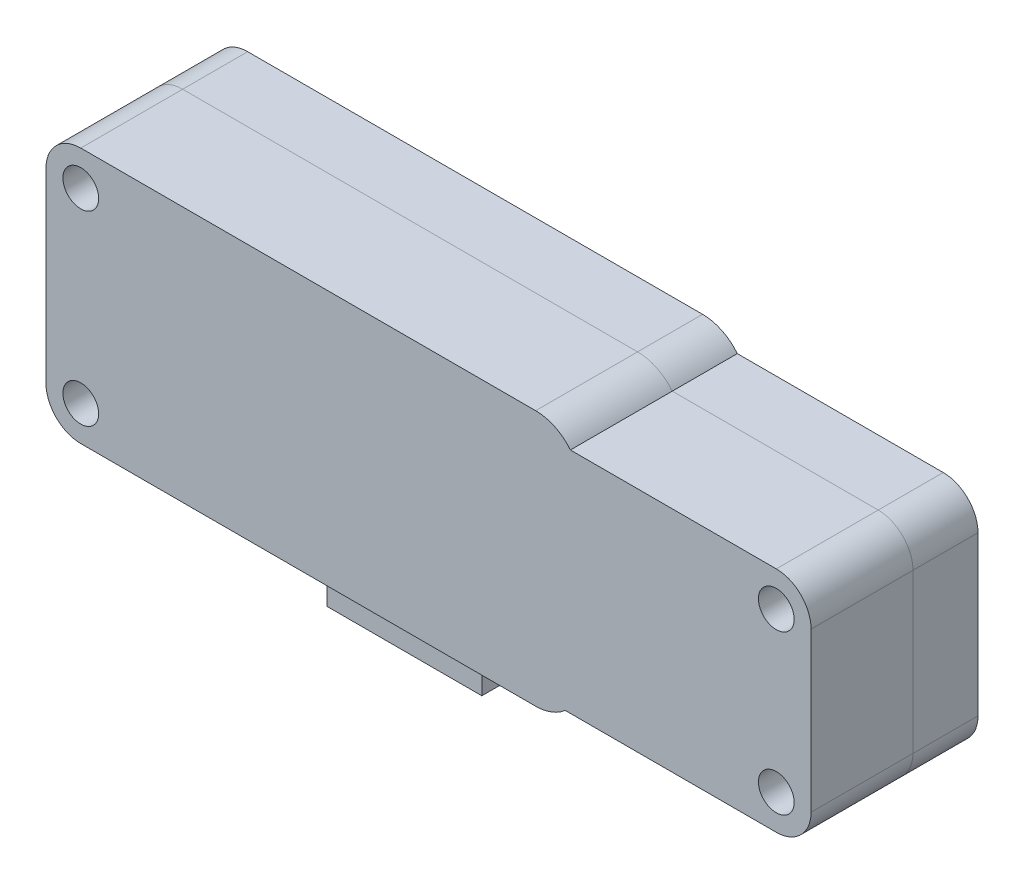
from build123d import *

# Parameters (mm, degrees)
BOSS_EXTRUDE1_START             = 2.032
BOSS_EXTRUDE1_DEPTH             = 12.7
BOSS_EXTRUDE2_DEPTH             = 3.27
BOSS_EXTRUDE2_DEPTH_BACK        = 3.27
SKETCH2_W                       = 14.14
SKETCH2_H                       = 7.9502
SKETCH3_W                       = 36.079999008
SKETCH3_H                       = 20.829999962
BOSS_EXTRUDE3_DEPTH             = 2.54
BOSS_EXTRUDE3_DIRECTION_2_REACH = 31.949
SKETCH7_W                       = 6.024
SKETCH7_H                       = 3.524
CUT_EXTRUDE1_DEPTH              = 2.54
BOSS_EXTRUDE5_DEPTH             = 12.7
F_4_CLEARANCE_HOLE4_D           = 3.2639
BOSS_EXTRUDE6_DEPTH             = 15.24
F_4_CLEARANCE_HOLE5_D           = 3.2639
SKETCH17_R                      = 1.63195
BOSS_EXTRUDE8_DEPTH             = 2.54


with BuildPart() as part:
    # Sketch1 → Boss-Extrude1 (new body)
    with BuildSketch(Plane.XY.offset(BOSS_EXTRUDE1_START)):
        with BuildLine():
            Line((-21.844, 7.62), (-21.844, -7.62))
            ThreePointArc((-21.844, -7.62), (-20.653681959, -10.493681959), (-17.78, -11.684))
            Line((-17.78, -11.684), (17.78, -11.684))
            ThreePointArc((17.78, -11.684), (20.653681959, -10.493681959), (21.844, -7.62))
            Line((21.844, -7.62), (21.844, 7.62))
            ThreePointArc((21.844, 7.62), (20.653681959, 10.493681959), (17.78, 11.684))
            Line((17.78, 11.684), (-17.78, 11.684))
            ThreePointArc((-17.78, 11.684), (-20.653681959, 10.493681959), (-21.844, 7.62))
        make_face()
    extrude(amount=-BOSS_EXTRUDE1_DEPTH)

    # Sketch2 → Boss-Extrude2 (add, two sides: drawn at the far end of the back side and taken through both)
    with BuildSketch(Plane(origin=(0, 0, -4), x_dir=(-1, 0, 0), z_dir=(0, 0, -1)).offset(-BOSS_EXTRUDE2_DEPTH_BACK)):
        with Locations((-3.036000992, -12.10347265)):
            Rectangle(SKETCH2_W, SKETCH2_H)
    extrude(amount=BOSS_EXTRUDE2_DEPTH + BOSS_EXTRUDE2_DEPTH_BACK)

    # Sketch3 → Boss-Extrude3 (add)
    with BuildSketch(Plane(origin=(0, 0, -10.668), x_dir=(-1, 0, 0), z_dir=(0, 0, -1))):
        with Locations((-19.806000496, -0.253372669)):
            Rectangle(SKETCH3_W, SKETCH3_H)
    extrude(amount=BOSS_EXTRUDE3_DEPTH)

    # Boss-Extrude3 direction 2: up to this face of the body (flat: up to its plane)
    boss_extrude3_direction_2_end = Plane(part.part.faces().sort_by_distance((0, 0, 2.032))[0])
    # Sketch3 → Boss-Extrude3 direction 2 (add, up to the picked face)
    with BuildSketch(Plane(origin=(0, 0, -10.668), x_dir=(-1, 0, 0), z_dir=(0, 0, -1)), mode=Mode.PRIVATE) as boss_extrude3_direction_2_sk1:
        with Locations((-19.806000496, -0.253372669)):
            Rectangle(SKETCH3_W, SKETCH3_H)
    boss_extrude3_direction_2_tool1 = split(extrude(boss_extrude3_direction_2_sk1.sketch, amount=-BOSS_EXTRUDE3_DIRECTION_2_REACH, mode=Mode.PRIVATE), bisect_by=boss_extrude3_direction_2_end, keep=Keep.BOTH, mode=Mode.PRIVATE)
    add(boss_extrude3_direction_2_tool1.solids().sort_by(Axis((19.806, -0.253373, -10.668), (0, 0, 1)))[0])

    # Sketch7 → Cut-Extrude1 (cut)
    with BuildSketch(Plane.XZ.offset(16.07857265)):
        with Locations((3.036000992, -4)):
            Rectangle(SKETCH7_W, SKETCH7_H)
    extrude(amount=-CUT_EXTRUDE1_DEPTH, mode=Mode.SUBTRACT)

    # Sketch11 → Boss-Extrude5 (add, through all)
    with BuildSketch(Plane(origin=(0, 0, -10.668), x_dir=(-1, 0, 0), z_dir=(0, 0, -1))):
        with BuildLine():
            Line((17.78, 11.684), (23.749, 11.684))
            ThreePointArc((23.749, 11.684), (25.99406403, 10.75406403), (26.924, 8.509))
            Line((26.924, 8.509), (26.924, -8.509))
            ThreePointArc((26.924, -8.509), (25.99406403, -10.75406403), (23.749, -11.684))
            Line((23.749, -11.684), (17.78, -11.684))
            Line((17.78, -11.684), (-17.78, -11.684))
            ThreePointArc((-17.78, -11.684), (-19.216577452, -11.421623499), (-20.467660727, -10.66837265))
            Line((-20.467660727, -10.66837265), (-1.766000992, -10.66837265))
            Line((-1.766000992, -10.66837265), (-1.766000992, 10.161627312))
            Line((-1.766000992, 10.161627312), (-20.951155406, 10.161627312))
            ThreePointArc((-20.951155406, 10.161627312), (-19.538823841, 11.283691403), (-17.78, 11.684))
            Line((-17.78, 11.684), (17.78, 11.684))
        make_face()
    extrude(amount=-BOSS_EXTRUDE5_DEPTH)

    # #4 Clearance Hole4 (through all)
    with Locations(Plane(origin=(0, 0, -10.668), x_dir=(-1, 0, 0), z_dir=(0, 0, -1))):
        with Locations((23.749, 8.509), (23.749, -8.509)):
            Hole(F_4_CLEARANCE_HOLE4_D / 2)

    # Sketch14 → Boss-Extrude6 (add, through all)
    with BuildSketch(Plane(origin=(0, 0, -13.208), x_dir=(-1, 0, 0), z_dir=(0, 0, -1))):
        with BuildLine():
            Line((-37.846, 10.161627312), (-39.751, 10.161627312))
            ThreePointArc((-39.751, 10.161627312), (-41.99606403, 9.231691342), (-42.926, 6.986627312))
            Line((-42.926, 6.986627312), (-42.926, -7.49337265))
            ThreePointArc((-42.926, -7.49337265), (-41.99606403, -9.73843668), (-39.751, -10.66837265))
            Line((-39.751, -10.66837265), (-37.846, -10.66837265))
            Line((-37.846, -10.66837265), (-37.846, 10.161627312))
        make_face()
    extrude(amount=-BOSS_EXTRUDE6_DEPTH)

    # #4 Clearance Hole5 (through all)
    with Locations(Plane(origin=(0, 0, -13.208), x_dir=(-1, 0, 0), z_dir=(0, 0, -1))):
        with Locations((-39.751, 6.986627312), (-39.751, -7.49337265)):
            Hole(F_4_CLEARANCE_HOLE5_D / 2)

    # Sketch17 → Boss-Extrude8 (add)
    with BuildSketch(Plane(origin=(0, 0, -10.668), x_dir=(-1, 0, 0), z_dir=(0, 0, -1))):
        with BuildLine():
            Line((-17.78, -11.684), (23.749, -11.684))
            ThreePointArc((23.749, -11.684), (25.99406403, -10.75406403), (26.924, -8.509))
            Line((26.924, -8.509), (26.924, 8.509))
            ThreePointArc((26.924, 8.509), (25.99406403, 10.75406403), (23.749, 11.684))
            Line((23.749, 11.684), (-17.78, 11.684))
            ThreePointArc((-17.78, 11.684), (-19.538823841, 11.283691403), (-20.951155406, 10.161627312))
            Line((-20.951155406, 10.161627312), (-1.766000992, 10.161627312))
            Line((-1.766000992, 10.161627312), (-1.766000992, -10.66837265))
            Line((-1.766000992, -10.66837265), (-20.467660727, -10.66837265))
            ThreePointArc((-20.467660727, -10.66837265), (-19.216577452, -11.421623499), (-17.78, -11.684))
        make_face()
        with Locations((23.749, 8.509)):
            Circle(SKETCH17_R, mode=Mode.SUBTRACT)
        with Locations((23.749, -8.509)):
            Circle(SKETCH17_R, mode=Mode.SUBTRACT)
    extrude(amount=BOSS_EXTRUDE8_DEPTH)


with BuildPart() as body_2:
    # Split1: the piece on the far side of the plane
    add(part.part)
    split(bisect_by=Plane(origin=(0, 0, -7.27), x_dir=(-1, 0, 0), z_dir=(0, 0, -1)), keep=Keep.BOTTOM)


with BuildPart() as part_1:
    add(part.part)

    # Split1
    split(bisect_by=Plane(origin=(0, 0, -7.27), x_dir=(-1, 0, 0), z_dir=(0, 0, -1)), keep=Keep.TOP)


solid = Compound([body_2.part, part_1.part])
